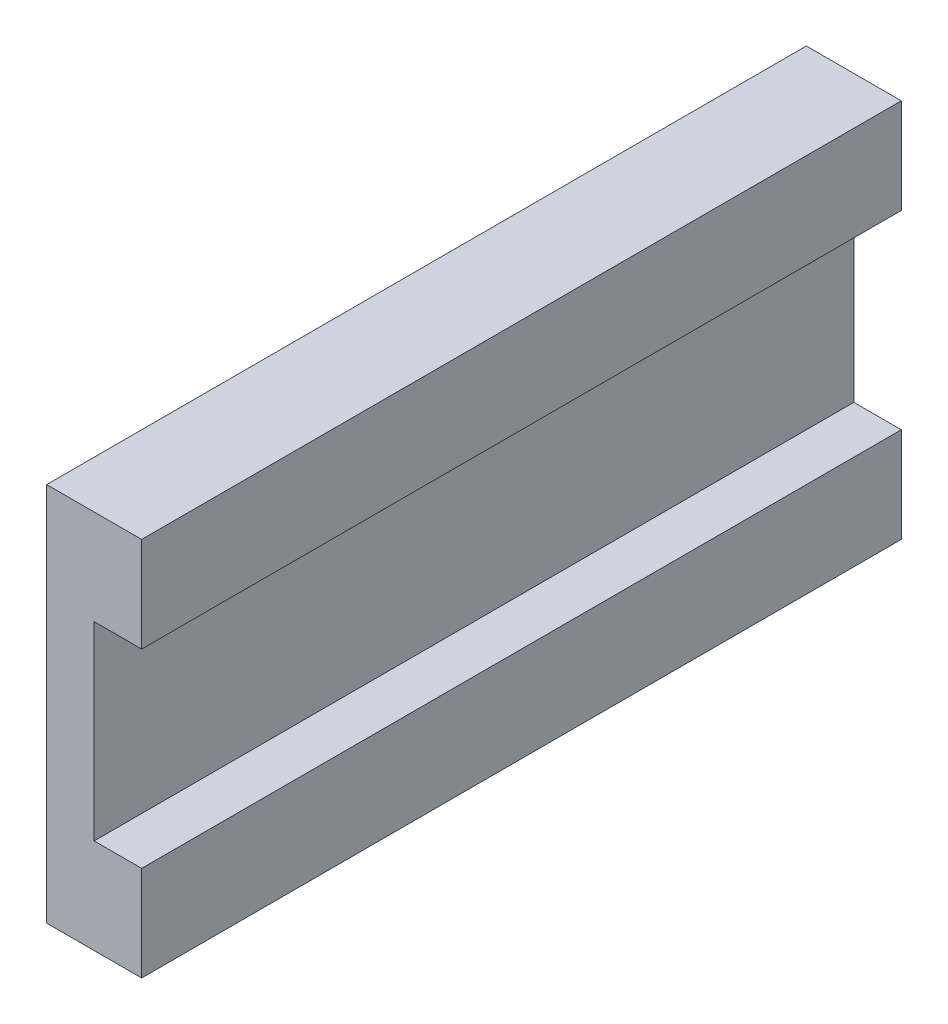
from build123d import *

# Parameters (mm, degrees)
BOSS_EXTRUDE1_DEPTH = 80


with BuildPart() as part:
    # Sketch1 → Boss-Extrude1 (new, symmetric)
    with BuildSketch(Plane.XY):
        Polygon((0, 0), (0, 80), (20, 80), (20, 60), (10, 60), (10, 20), (20, 20), (20, 0), align=None)
    extrude(amount=BOSS_EXTRUDE1_DEPTH, both=True)


solid = part.part
